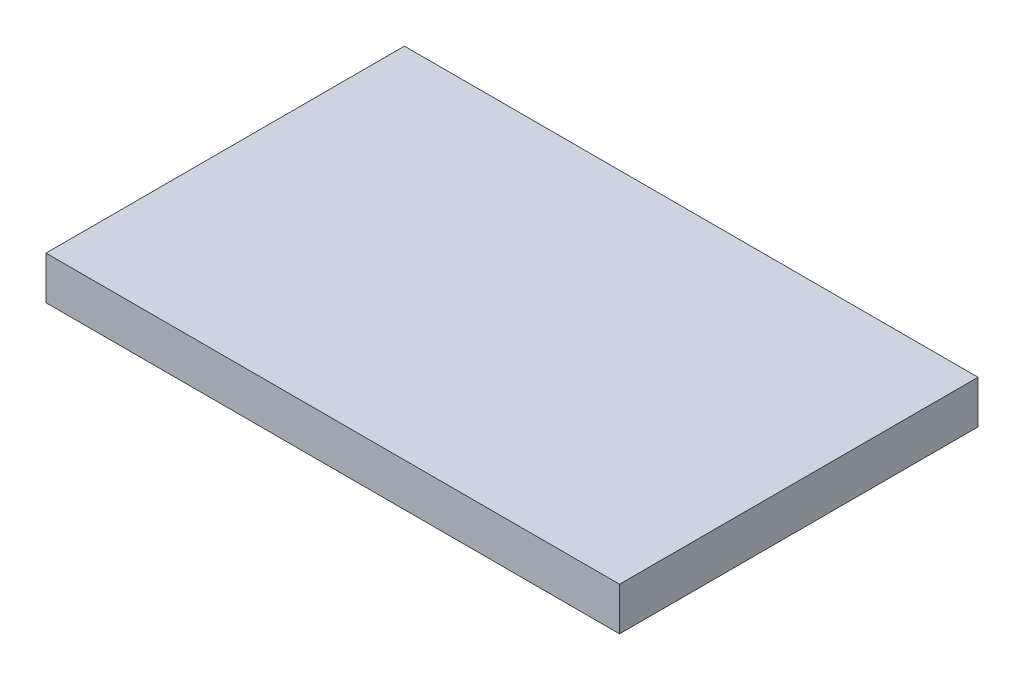
from build123d import *

# Parameters (mm, degrees)
SKETCH2_W           = 40
SKETCH2_H           = 25
BOSS_EXTRUDE1_DEPTH = 3


with BuildPart() as part:
    # Sketch2 → Boss-Extrude1 (new body)
    with BuildSketch(Plane(origin=(0, 0, 0), x_dir=(1, 0, 0), z_dir=(0, 1, 0))):
        Rectangle(SKETCH2_W, SKETCH2_H)
    extrude(amount=-BOSS_EXTRUDE1_DEPTH)


solid = part.part
